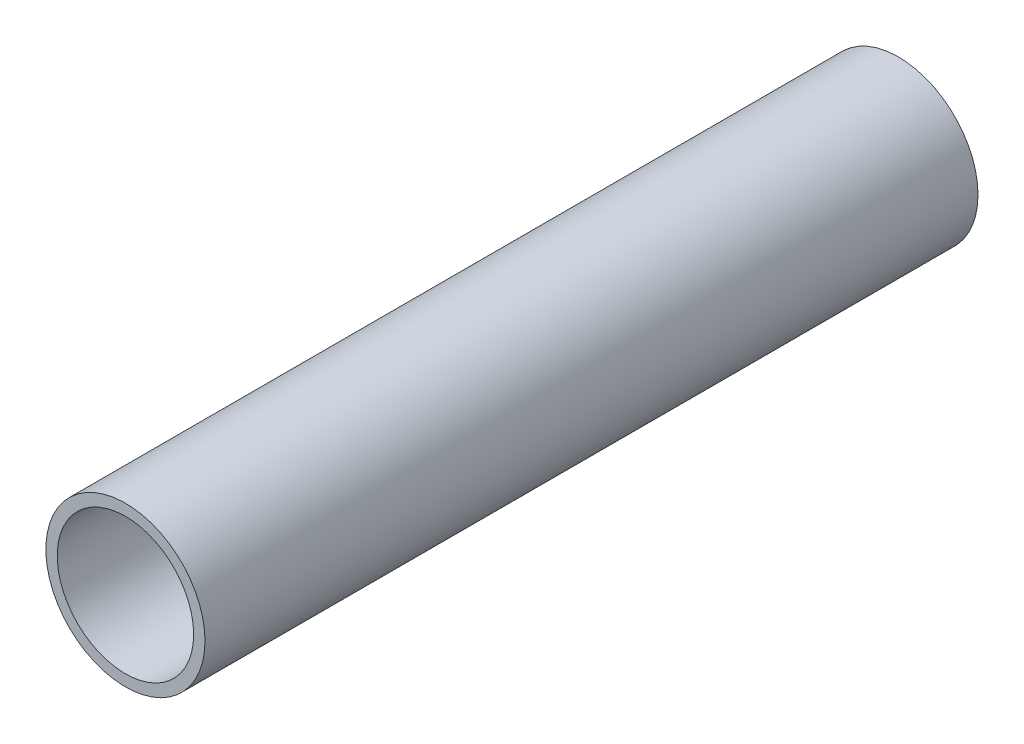
from build123d import *

# Parameters (mm, degrees)
ESQUISSE1_R          = 1.75
ESQUISSE1_R_2        = 1.5
BASE_EXTRUSION_DEPTH = 17


with BuildPart() as part:
    # Esquisse1 → Base-Extrusion (new body)
    with BuildSketch(Plane.XY):
        Circle(ESQUISSE1_R)
        Circle(ESQUISSE1_R_2, mode=Mode.SUBTRACT)
    extrude(amount=-BASE_EXTRUSION_DEPTH)


solid = part.part
